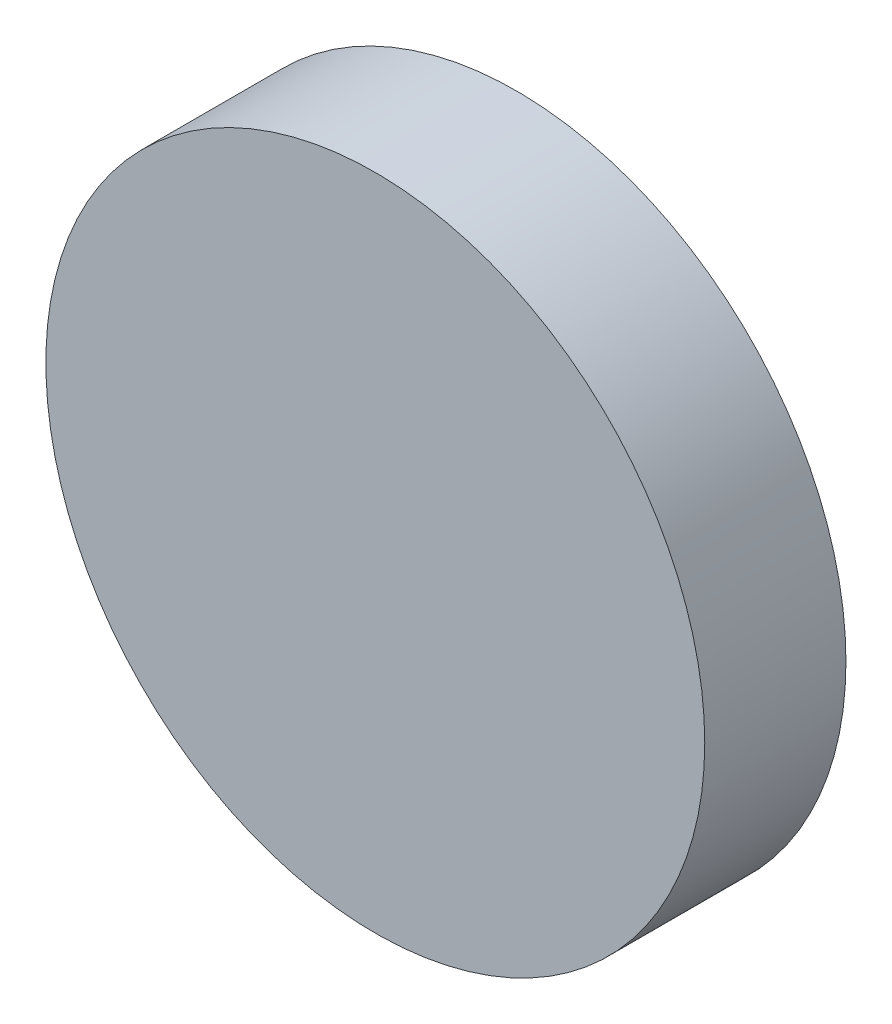
from build123d import *

# Parameters (mm, degrees)
SKETCH1_R           = 3.5
BOSS_EXTRUDE1_DEPTH = 1.5


with BuildPart() as part:
    # Sketch1 → Boss-Extrude1 (new body)
    with BuildSketch(Plane.XY):
        Circle(SKETCH1_R)
    extrude(amount=BOSS_EXTRUDE1_DEPTH)


solid = part.part
